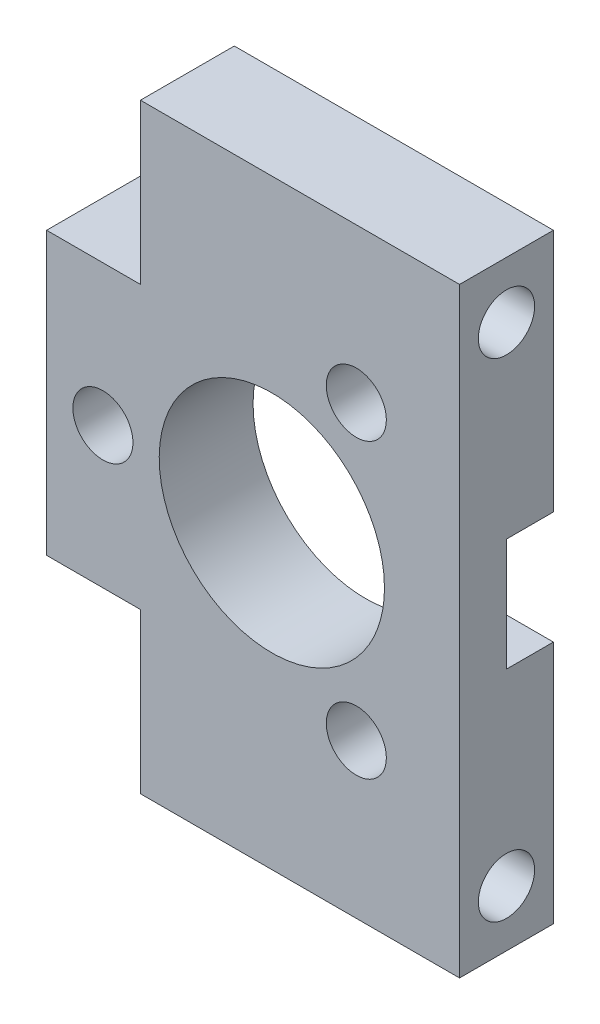
from build123d import *

# Parameters (mm, degrees)
ESQUISSE1_R             = 6
ESQUISSE1_R_2           = 1.6
EXTRUSION1_DEPTH        = 5
ESQUISSE2_W             = 10
ESQUISSE2_H             = 6
ENL_V_MAT_EXTRU_1_DEPTH = 2.5
ESQUISSE3_R             = 1.5
ENL_V_MAT_EXTRU_2_DEPTH = 28.658633372


with BuildPart() as part:
    # Esquisse1 → Extrusion1 (new body)
    with BuildSketch(Plane.XY):
        Polygon((-7, 16), (10, 16), (10, -16), (-7, -16), (-7, -7.5), (-12, -7.5), (-12, 7.5), (-7, 7.5), align=None)
        Circle(ESQUISSE1_R, mode=Mode.SUBTRACT)
        with Locations((-9, 0)):
            Circle(ESQUISSE1_R_2, mode=Mode.SUBTRACT)
        with Locations((4.5, 7.794228634)):
            Circle(ESQUISSE1_R_2, mode=Mode.SUBTRACT)
        with Locations((4.5, -7.794228634)):
            Circle(ESQUISSE1_R_2, mode=Mode.SUBTRACT)
    extrude(amount=EXTRUSION1_DEPTH)

    # Esquisse2 → Enlèv. mat.-Extru.1 (cut)
    with BuildSketch(Plane(origin=(0, 0, 0), x_dir=(-1, 0, 0), z_dir=(0, 0, -1))):
        with Locations((-5, 0)):
            Rectangle(ESQUISSE2_W, ESQUISSE2_H)
    extrude(amount=-ENL_V_MAT_EXTRU_1_DEPTH, mode=Mode.SUBTRACT)

    # Esquisse3 → Enlèv. mat.-Extru.2 (cut, through all)
    with BuildSketch(Plane.ZY.offset(12)):
        with Locations((2.5, 13)):
            Circle(ESQUISSE3_R)
        with Locations((2.5, -13)):
            Circle(ESQUISSE3_R)
    extrude(amount=-ENL_V_MAT_EXTRU_2_DEPTH, mode=Mode.SUBTRACT)


solid = part.part
